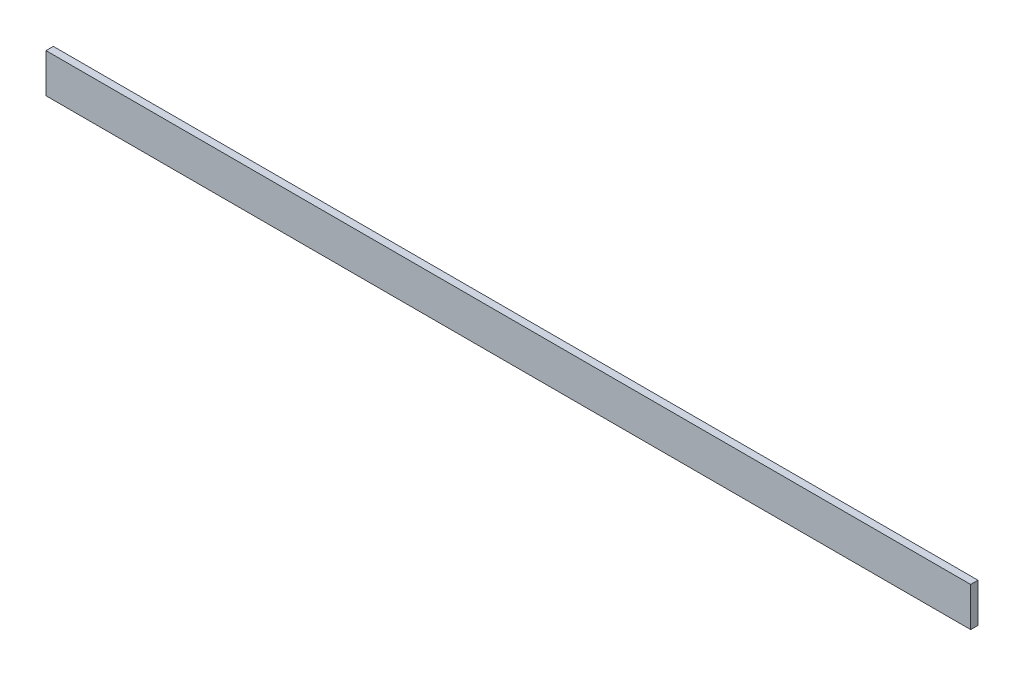
from build123d import *

# Parameters (mm, degrees)
SKETCH2_W           = 2400.3
SKETCH2_H           = 101.6
BOSS_EXTRUDE1_DEPTH = 19.05


with BuildPart() as part:
    # Sketch2 → Boss-Extrude1 (new body)
    with BuildSketch(Plane.XY):
        Rectangle(SKETCH2_W, SKETCH2_H)
    extrude(amount=BOSS_EXTRUDE1_DEPTH)


solid = part.part
